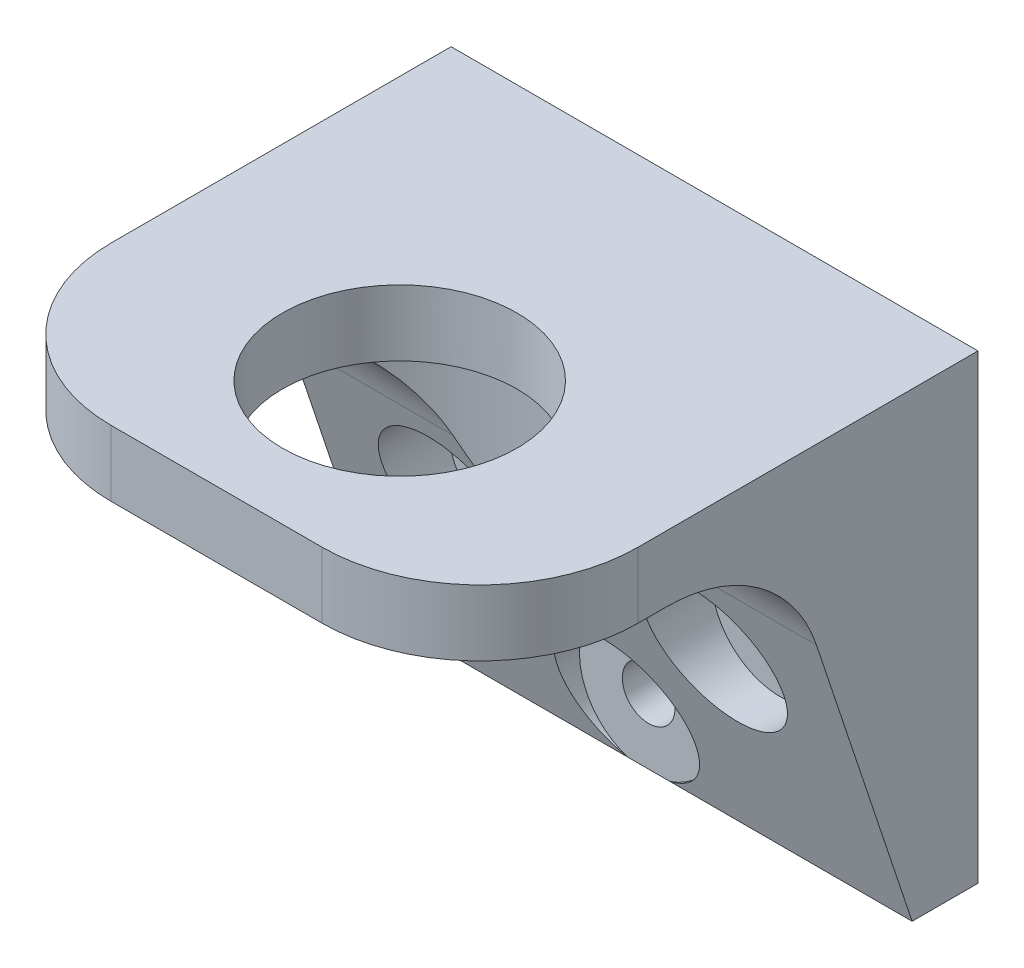
from build123d import *

# Parameters (mm, degrees)
SKETCH1_W           = 50.8
SKETCH1_H           = 44.45
BOSS_EXTRUDE1_DEPTH = 6.35
BOSS_EXTRUDE2_DEPTH = 50.8
SKETCH3_R           = 11.303
CUT_EXTRUDE1_DEPTH  = 50.8
SKETCH4_R           = 2.54
CUT_EXTRUDE2_DEPTH  = 50.8
SKETCH5_R           = 6.6675
CUT_EXTRUDE3_DEPTH  = 41.656
SKETCH6_R           = 17.653
CUT_EXTRUDE4_DEPTH  = 50.8
FILLET1_R           = 15.24


with BuildPart() as part:
    # Sketch1 → Boss-Extrude1 (new body)
    with BuildSketch(Plane.XY):
        with Locations((25.4, 22.225)):
            Rectangle(SKETCH1_W, SKETCH1_H)
    extrude(amount=BOSS_EXTRUDE1_DEPTH)

    # Sketch2 → Boss-Extrude2 (add)
    with BuildSketch(Plane(origin=(50.8, 0, 0), x_dir=(0, 0, -1), z_dir=(1, 0, 0))):
        Polygon((-6.35, 0), (-6.35, 44.45), (-48.006, 44.45), (-48.006, 38.1), (-19.05, 38.1), align=None)
    extrude(amount=-BOSS_EXTRUDE2_DEPTH)

    # Sketch3 → Cut-Extrude1 (cut)
    with BuildSketch(Plane(origin=(0, 44.45, 0), x_dir=(1, 0, 0), z_dir=(0, 1, 0))):
        with Locations(Location((25.4, -30.353, 0), (0, 0, 270))):
            Circle(SKETCH3_R)
    extrude(amount=-CUT_EXTRUDE1_DEPTH, mode=Mode.SUBTRACT)

    # Sketch4 → Cut-Extrude2 (cut)
    with BuildSketch(Plane(origin=(0, 0, 0), x_dir=(-1, 0, 0), z_dir=(0, 0, -1))):
        with Locations((-25.4, 6.35)):
            Circle(SKETCH4_R)
        with Locations((-38.1, 19.05)):
            Circle(SKETCH4_R)
        with Locations((-12.7, 19.05)):
            Circle(SKETCH4_R)
    extrude(amount=-CUT_EXTRUDE2_DEPTH, mode=Mode.SUBTRACT)

    # Sketch5 → Cut-Extrude3 (cut)
    with BuildSketch(Plane.XY.offset(48.006)):
        with Locations((12.7, 19.05)):
            Circle(SKETCH5_R)
        with Locations((38.1, 19.05)):
            Circle(SKETCH5_R)
        with Locations((25.4, 6.35)):
            Circle(SKETCH5_R)
    extrude(amount=-CUT_EXTRUDE3_DEPTH, mode=Mode.SUBTRACT)

    # Sketch6 → Cut-Extrude4 (cut)
    with BuildSketch(Plane.XZ.offset(-38.1)):
        with Locations((25.4, 30.353)):
            Circle(SKETCH6_R)
    extrude(amount=CUT_EXTRUDE4_DEPTH, mode=Mode.SUBTRACT)

    # Fillet1
    fillet1_edges = [part.edges().sort_by_distance(p)[0] for p in [
        (5.92005531, 38.1, 19.05),
        (44.87994469, 38.1, 19.05),
        (50.8, 41.275, 48.006),
        (0, 41.275, 48.006),
    ]]
    fillet(fillet1_edges, radius=FILLET1_R)


solid = part.part
